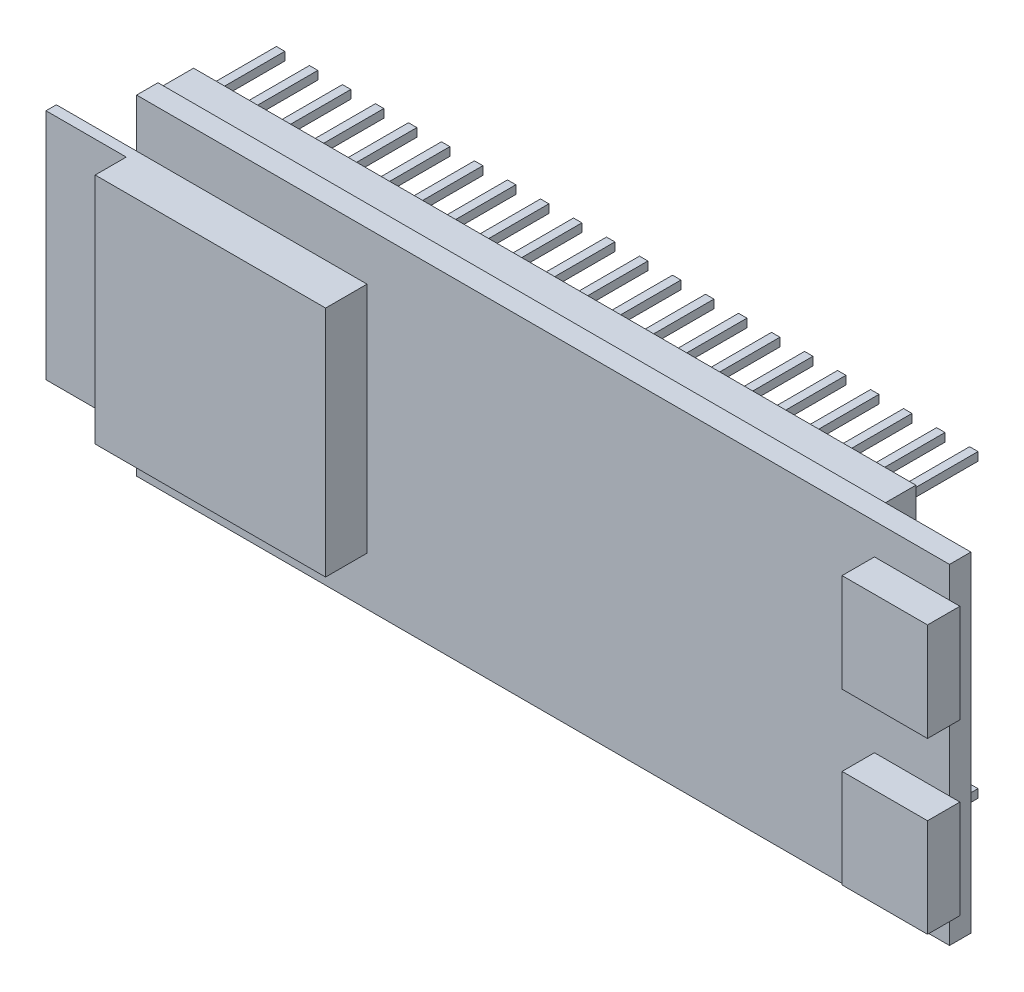
from build123d import *

# Parameters (mm, degrees)
SKETCH1_W           = 62.8
SKETCH1_H           = 25.5
BOSS_EXTRUDE1_DEPTH = 0.825
SKETCH2_W           = 6.2
SKETCH2_H           = 18
SKETCH2_W_2         = 11.6
BOSS_EXTRUDE2_DEPTH = 0.8
SKETCH3_W           = 6.2
SKETCH3_H           = 18
SKETCH3_W_2         = 11.6
BOSS_EXTRUDE3_DEPTH = 2.4
SKETCH5_W           = 6.6
SKETCH5_H           = 7.6
BOSS_EXTRUDE4_DEPTH = 2.5
SKETCH6_W           = 62.4
SKETCH6_H           = 2.55
BOSS_EXTRUDE5_DEPTH = 2.55
SKETCH7_W           = 0.65
SKETCH7_H           = 0.65
BOSS_EXTRUDE6_DEPTH = 5.6
SKETCH8_W           = 6.6
SKETCH8_H           = 2.55
CUT_EXTRUDE1_DEPTH  = 41.530790765


with BuildPart() as part:
    # Sketch1 → Boss-Extrude1 (new, symmetric)
    with BuildSketch(Plane.XY):
        Rectangle(SKETCH1_W, SKETCH1_H)
    extrude(amount=BOSS_EXTRUDE1_DEPTH, both=True)

    # Sketch2 → Boss-Extrude2 (add)
    with BuildSketch(Plane.XY.offset(0.825)):
        with Locations((-34.5, 0)):
            Rectangle(SKETCH2_W, SKETCH2_H)
        with Locations((-28.3, 0)):
            Rectangle(SKETCH2_W, SKETCH2_H)
        with Locations((-19.4, 0)):
            Rectangle(SKETCH2_W_2, SKETCH2_H)
    extrude(amount=BOSS_EXTRUDE2_DEPTH)

    # Sketch3 → Boss-Extrude3 (add)
    with BuildSketch(Plane.XY.offset(1.625)):
        with Locations((-28.3, 0)):
            Rectangle(SKETCH3_W, SKETCH3_H)
        with Locations((-19.4, 0)):
            Rectangle(SKETCH3_W_2, SKETCH3_H)
    extrude(amount=BOSS_EXTRUDE3_DEPTH)

    # Sketch5 → Boss-Extrude4 (add)
    with BuildSketch(Plane.XY.offset(0.825)):
        with Locations((28.9, -6.55)):
            Rectangle(SKETCH5_W, SKETCH5_H)
        with Locations((28.9, 6.55)):
            Rectangle(SKETCH5_W, SKETCH5_H)
    extrude(amount=BOSS_EXTRUDE4_DEPTH)

    # Sketch6 → Boss-Extrude5 (add)
    with BuildSketch(Plane(origin=(0, 0, -0.825), x_dir=(-1, 0, 0), z_dir=(0, 0, -1))):
        with Locations((0, 11.275)):
            Rectangle(SKETCH6_W, SKETCH6_H)
        with Locations((0, -11.275)):
            Rectangle(SKETCH6_W, SKETCH6_H)
    extrude(amount=BOSS_EXTRUDE5_DEPTH)

    # Sketch7 → Boss-Extrude6 (add)
    with BuildSketch(Plane(origin=(0, 0, -3.375), x_dir=(-1, 0, 0), z_dir=(0, 0, -1))):
        with Locations((-20.925, 11.275)):
            Rectangle(SKETCH7_W, SKETCH7_H)
        with Locations((-23.475, 11.275)):
            Rectangle(SKETCH7_W, SKETCH7_H)
        with Locations((-18.375, 11.275)):
            Rectangle(SKETCH7_W, SKETCH7_H)
        with Locations((-15.825, 11.275)):
            Rectangle(SKETCH7_W, SKETCH7_H)
        with Locations((-13.275, 11.275)):
            Rectangle(SKETCH7_W, SKETCH7_H)
        with Locations((-10.725, 11.275)):
            Rectangle(SKETCH7_W, SKETCH7_H)
        with Locations((-8.175, 11.275)):
            Rectangle(SKETCH7_W, SKETCH7_H)
        with Locations((-5.625, 11.275)):
            Rectangle(SKETCH7_W, SKETCH7_H)
        with Locations((-3.075, 11.275)):
            Rectangle(SKETCH7_W, SKETCH7_H)
        with Locations((-0.525, 11.275)):
            Rectangle(SKETCH7_W, SKETCH7_H)
        with Locations((2.025, 11.275)):
            Rectangle(SKETCH7_W, SKETCH7_H)
        with Locations((4.575, 11.275)):
            Rectangle(SKETCH7_W, SKETCH7_H)
        with Locations((7.125, 11.275)):
            Rectangle(SKETCH7_W, SKETCH7_H)
        with Locations((9.675, 11.275)):
            Rectangle(SKETCH7_W, SKETCH7_H)
        with Locations((12.225, 11.275)):
            Rectangle(SKETCH7_W, SKETCH7_H)
        with Locations((14.775, 11.275)):
            Rectangle(SKETCH7_W, SKETCH7_H)
        with Locations((17.325, 11.275)):
            Rectangle(SKETCH7_W, SKETCH7_H)
        with Locations((19.875, 11.275)):
            Rectangle(SKETCH7_W, SKETCH7_H)
        with Locations((22.425, 11.275)):
            Rectangle(SKETCH7_W, SKETCH7_H)
        with Locations((24.975, 11.275)):
            Rectangle(SKETCH7_W, SKETCH7_H)
        with Locations((27.525, 11.275)):
            Rectangle(SKETCH7_W, SKETCH7_H)
        with Locations((30.075, 11.275)):
            Rectangle(SKETCH7_W, SKETCH7_H)
        with Locations((30.075, -11.275)):
            Rectangle(SKETCH7_W, SKETCH7_H)
        with Locations((27.525, -11.275)):
            Rectangle(SKETCH7_W, SKETCH7_H)
        with Locations((24.975, -11.275)):
            Rectangle(SKETCH7_W, SKETCH7_H)
        with Locations((22.425, -11.275)):
            Rectangle(SKETCH7_W, SKETCH7_H)
        with Locations((19.875, -11.275)):
            Rectangle(SKETCH7_W, SKETCH7_H)
        with Locations((17.325, -11.275)):
            Rectangle(SKETCH7_W, SKETCH7_H)
        with Locations((14.775, -11.275)):
            Rectangle(SKETCH7_W, SKETCH7_H)
        with Locations((12.225, -11.275)):
            Rectangle(SKETCH7_W, SKETCH7_H)
        with Locations((9.675, -11.275)):
            Rectangle(SKETCH7_W, SKETCH7_H)
        with Locations((7.125, -11.275)):
            Rectangle(SKETCH7_W, SKETCH7_H)
        with Locations((4.575, -11.275)):
            Rectangle(SKETCH7_W, SKETCH7_H)
        with Locations((2.025, -11.275)):
            Rectangle(SKETCH7_W, SKETCH7_H)
        with Locations((-0.525, -11.275)):
            Rectangle(SKETCH7_W, SKETCH7_H)
        with Locations((-3.075, -11.275)):
            Rectangle(SKETCH7_W, SKETCH7_H)
        with Locations((-5.625, -11.275)):
            Rectangle(SKETCH7_W, SKETCH7_H)
        with Locations((-8.175, -11.275)):
            Rectangle(SKETCH7_W, SKETCH7_H)
        with Locations((-10.725, -11.275)):
            Rectangle(SKETCH7_W, SKETCH7_H)
        with Locations((-13.275, -11.275)):
            Rectangle(SKETCH7_W, SKETCH7_H)
        with Locations((-15.825, -11.275)):
            Rectangle(SKETCH7_W, SKETCH7_H)
        with Locations((-18.375, -11.275)):
            Rectangle(SKETCH7_W, SKETCH7_H)
        with Locations((-20.925, -11.275)):
            Rectangle(SKETCH7_W, SKETCH7_H)
        with Locations((-23.475, -11.275)):
            Rectangle(SKETCH7_W, SKETCH7_H)
    extrude(amount=BOSS_EXTRUDE6_DEPTH)

    # Sketch8 → Cut-Extrude1 (cut, through all)
    with BuildSketch(Plane(origin=(0, 0, -0.825), x_dir=(-1, 0, 0), z_dir=(0, 0, -1))):
        with Locations((-27.9, 11.275)):
            Rectangle(SKETCH8_W, SKETCH8_H)
        with Locations((-27.9, -11.275)):
            Rectangle(SKETCH8_W, SKETCH8_H)
    extrude(amount=CUT_EXTRUDE1_DEPTH, mode=Mode.SUBTRACT)


solid = part.part
